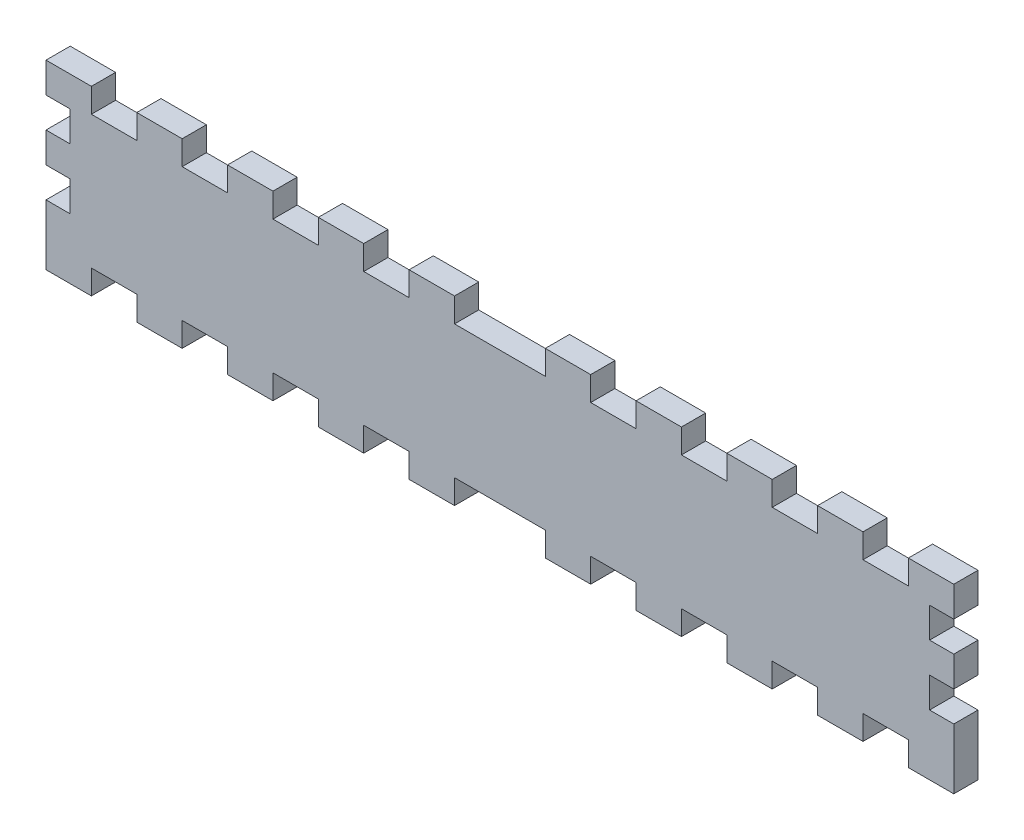
from build123d import *

# Parameters (mm, degrees)
ESQUISSE1_W             = 300
ESQUISSE1_H             = 60
BOSS_EXTRU_1_DEPTH      = 8
ESQUISSE2_W             = 15
ESQUISSE2_H             = 8
ENL_V_MAT_EXTRU_1_DEPTH = 8
ESQUISSE3_W             = 8
ESQUISSE3_H             = 10
ENL_V_MAT_EXTRU_2_DEPTH = 154.179633111


with BuildPart() as part:
    # Esquisse1 → Boss.-Extru.1 (new body)
    with BuildSketch(Plane.XY):
        Rectangle(ESQUISSE1_W, ESQUISSE1_H)
    extrude(amount=BOSS_EXTRU_1_DEPTH)

    # Esquisse2 → Enlèv. mat.-Extru.1 (cut)
    with BuildSketch(Plane.XY):
        Polygon((0, -30), (15, -30), (15, -22), (0, -22), (-15, -22), (-15, -30), align=None)
        with Locations((-127.5, -26)):
            Rectangle(ESQUISSE2_W, ESQUISSE2_H)
        with Locations((-97.5, -26)):
            Rectangle(ESQUISSE2_W, ESQUISSE2_H)
        with Locations((-67.5, -26)):
            Rectangle(ESQUISSE2_W, ESQUISSE2_H)
        with Locations((-37.5, -26)):
            Rectangle(ESQUISSE2_W, ESQUISSE2_H)
        with Locations((127.5, -26)):
            Rectangle(ESQUISSE2_W, ESQUISSE2_H)
        with Locations((97.5, -26)):
            Rectangle(ESQUISSE2_W, ESQUISSE2_H)
        with Locations((67.5, -26)):
            Rectangle(ESQUISSE2_W, ESQUISSE2_H)
        with Locations((37.5, -26)):
            Rectangle(ESQUISSE2_W, ESQUISSE2_H)
    enl_v_mat_extru_1 = extrude(amount=ENL_V_MAT_EXTRU_1_DEPTH, mode=Mode.SUBTRACT)

    # Esquisse3 → Enlèv. mat.-Extru.2 (cut, through all)
    with BuildSketch(Plane.XY):
        with Locations((-146, 15)):
            Rectangle(ESQUISSE3_W, ESQUISSE3_H)
        with Locations((-146, -5)):
            Rectangle(ESQUISSE3_W, ESQUISSE3_H)
    enl_v_mat_extru_2 = extrude(amount=ENL_V_MAT_EXTRU_2_DEPTH, mode=Mode.SUBTRACT)

    # Symétrie1: Enlèv. mat.-Extru.2 across plane
    add(enl_v_mat_extru_2.mirror(Plane(origin=(0, 0, 0), x_dir=(0, 0, 1), z_dir=(1, 0, 0))), mode=Mode.SUBTRACT)

    # Symétrie2: Enlèv. mat.-Extru.1 across plane
    add(enl_v_mat_extru_1.mirror(Plane.ZX), mode=Mode.SUBTRACT)


solid = part.part
